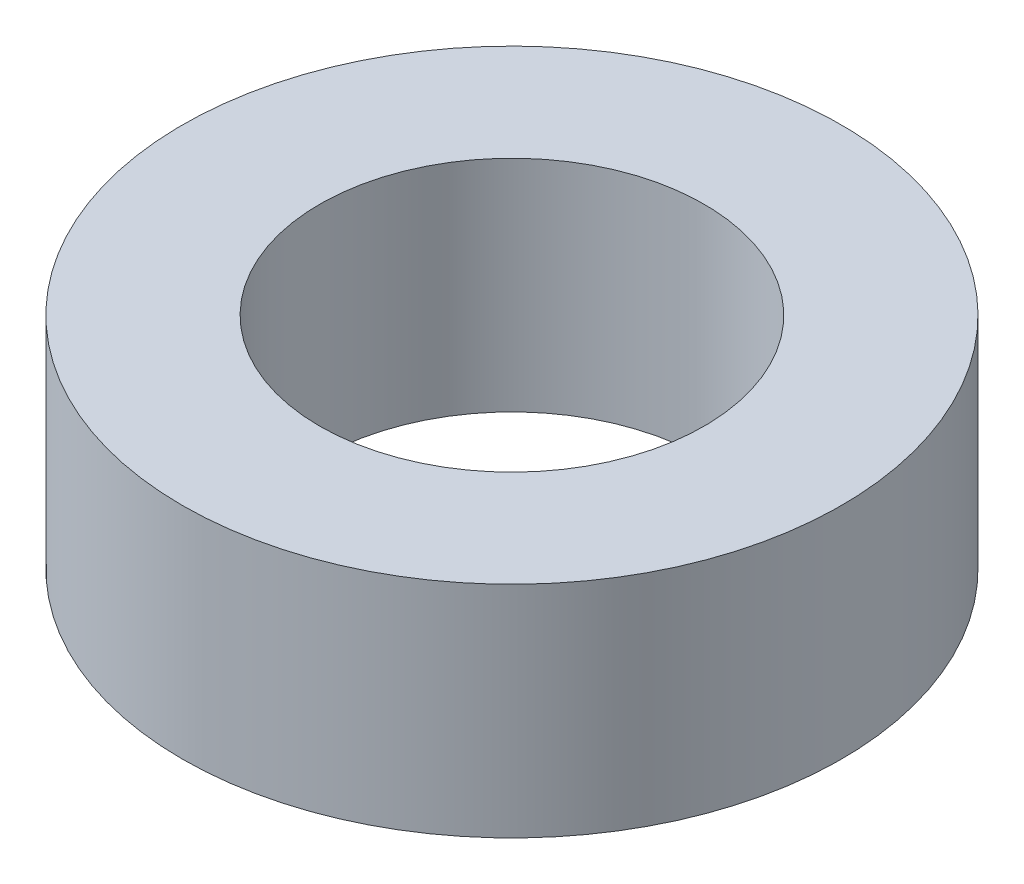
from build123d import *

# Parameters (mm, degrees)
SKETCH1_R           = 3
SKETCH1_R_2         = 1.75
BOSS_EXTRUDE1_DEPTH = 2


with BuildPart() as part:
    # Sketch1 → Boss-Extrude1 (new body)
    with BuildSketch(Plane(origin=(0, 0, 0), x_dir=(1, 0, 0), z_dir=(0, 1, 0))):
        with Locations(Location((0, 0, 0), (0, 0, 270))):
            Circle(SKETCH1_R)
        with Locations(Location((0, 0, 0), (0, 0, 270))):
            Circle(SKETCH1_R_2, mode=Mode.SUBTRACT)
    extrude(amount=BOSS_EXTRUDE1_DEPTH)


solid = part.part
